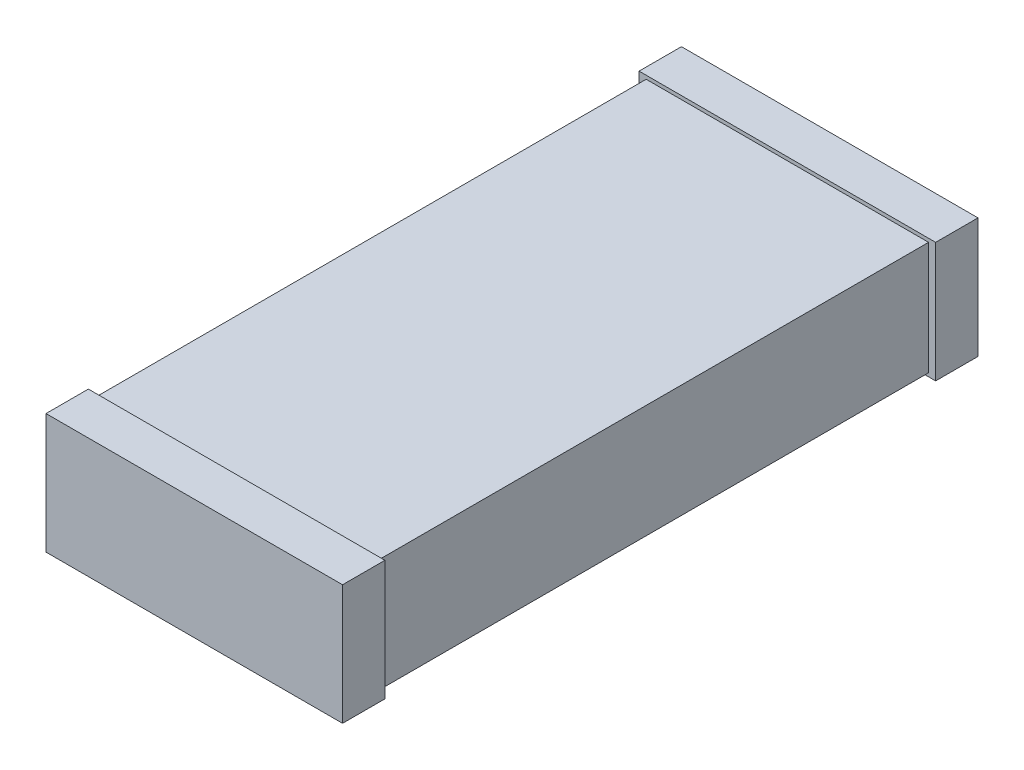
from build123d import *

# Parameters (mm, degrees)
SKETCH_1_W      = 2
SKETCH_1_H      = 0.8
EXTRUDE_1_DEPTH = 1.95
SKETCH_2_W      = 2.1
SKETCH_2_H      = 0.85
EXTRUDE_2_DEPTH = 0.3


with BuildPart() as part:
    # Эскиз1 → Бобышка-Вытянуть1 (new body)
    with BuildSketch(Plane.XY):
        Rectangle(SKETCH_1_W, SKETCH_1_H)
    extrude_1 = extrude(amount=EXTRUDE_1_DEPTH)

    # Эскиз2 → Бобышка-Вытянуть2 (add)
    with BuildSketch(Plane.XY.offset(1.95)):
        Rectangle(SKETCH_2_W, SKETCH_2_H)
    extrude_2 = extrude(amount=EXTRUDE_2_DEPTH)


with BuildPart() as mirror_1_1:
    # Зеркальное отражение1: Бобышка-Вытянуть1, Бобышка-Вытянуть2 across Front Plane
    add(extrude_1.mirror(Plane.XY))
    add(extrude_2.mirror(Plane.XY))


with BuildPart() as part_1:
    add(part.part)

    # Зеркальное отражение1 united with what the copies tou: union Зеркальное отражение1_1
    add(mirror_1_1.part)


solid = part_1.part
